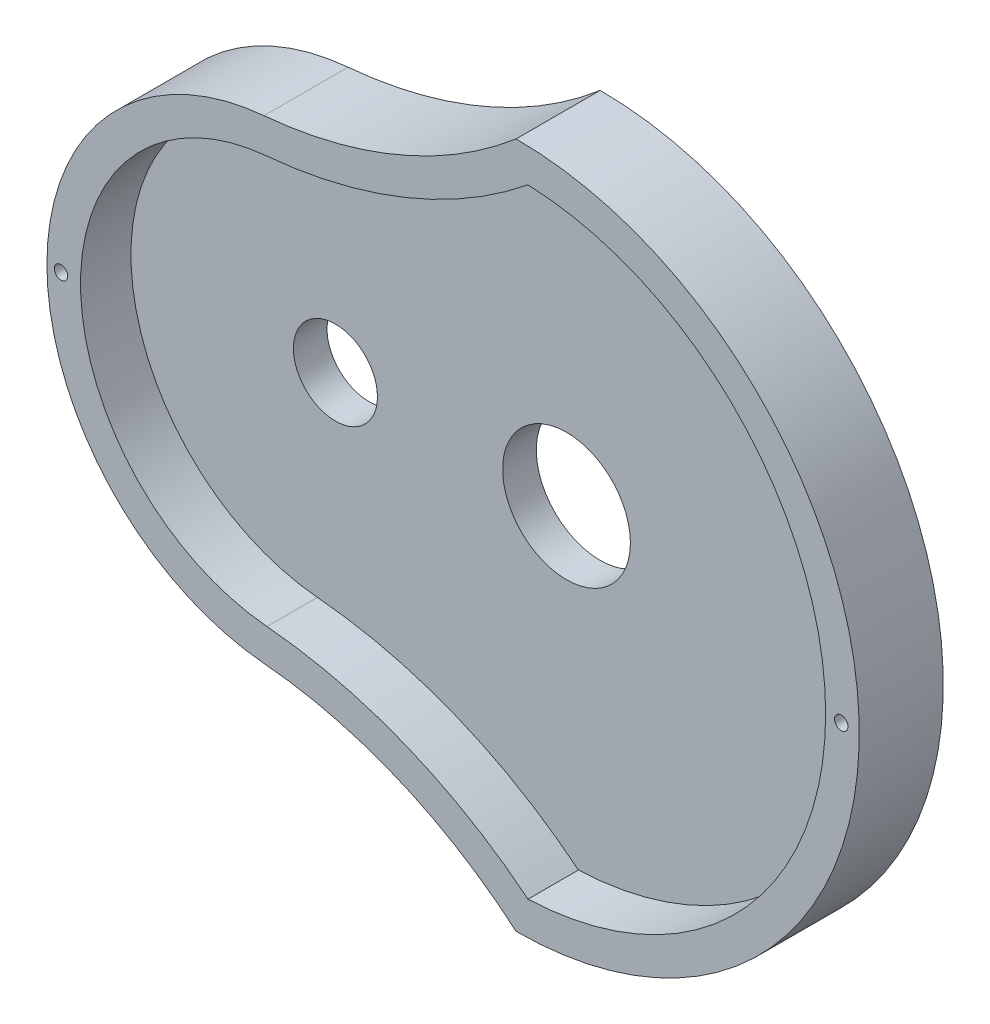
from build123d import *

# Parameters (mm, degrees)
BOSS_EXTRUDE1_DEPTH = 6.35
SHELL1_T            = -2.54
SKETCH3_R           = 4.826
SKETCH3_R_2         = 3.175
CUT_EXTRUDE1_DEPTH  = 2.54
SKETCH2_R           = 0.508
CUT_EXTRUDE2_DEPTH  = 1.27


with BuildPart() as part:
    # Sketch1 → Boss-Extrude1 (new body)
    with BuildSketch(Plane.XY):
        with BuildLine():
            ThreePointArc((0, -25.92959), (25.92959, 0), (0, 25.92959))
            ThreePointArc((0, 25.92959), (-8.900253562, 20.439501874), (-19.05, 17.921918042))
            ThreePointArc((-19.05, 17.921918042), (-35.45459, 0), (-19.05, -17.921918042))
            ThreePointArc((-19.05, -17.921918042), (-8.900253562, -20.439501874), (0, -25.92959))
        make_face()
    extrude(amount=BOSS_EXTRUDE1_DEPTH)

    # Shell1
    shell1_openings = [part.faces().sort_by_distance(p)[0] for p in [
        (-3.11409352, 0, 6.35),
    ]]
    offset(amount=SHELL1_T, openings=shell1_openings, kind=Kind.INTERSECTION)

    # Sketch3 → Cut-Extrude1 (cut)
    with BuildSketch(Plane.XY.offset(2.54)):
        Circle(SKETCH3_R)
        with Locations((-17.4625, 0)):
            Circle(SKETCH3_R_2)
    extrude(amount=-CUT_EXTRUDE1_DEPTH, mode=Mode.SUBTRACT)

    # Sketch2 → Cut-Extrude2 (cut)
    with BuildSketch(Plane.XY.offset(6.35)):
        with Locations((-34.39268404, 0)):
            Circle(SKETCH2_R)
        with Locations((24.569143143, 0)):
            Circle(SKETCH2_R)
    extrude(amount=-CUT_EXTRUDE2_DEPTH, mode=Mode.SUBTRACT)


solid = part.part
